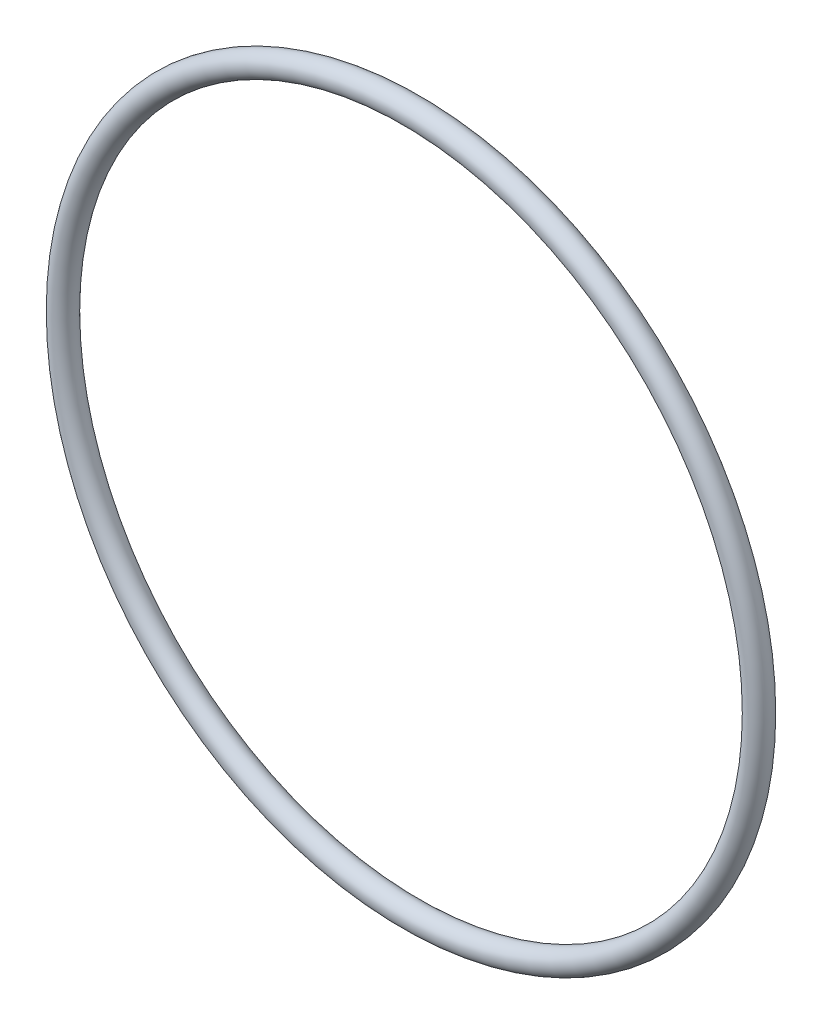
from build123d import *

# Parameters (mm, degrees)
SKETCH1_R = 0.889


with BuildPart() as part:
    # Sketch1 → Revolve1 (revolve)
    with BuildSketch(Plane(origin=(0, 0, 0), x_dir=(0, -1, 0), z_dir=(1, 0, 0)), mode=Mode.PRIVATE) as revolve1_sk:
        with Locations((26.1493, 0)):
            Circle(SKETCH1_R)
    revolve(revolve1_sk.sketch.rotate(Axis((0, 0, 0.889), (0, 0, -1)), 270), axis=Axis((0, 0, 0.889), (0, 0, -1)))


solid = part.part
